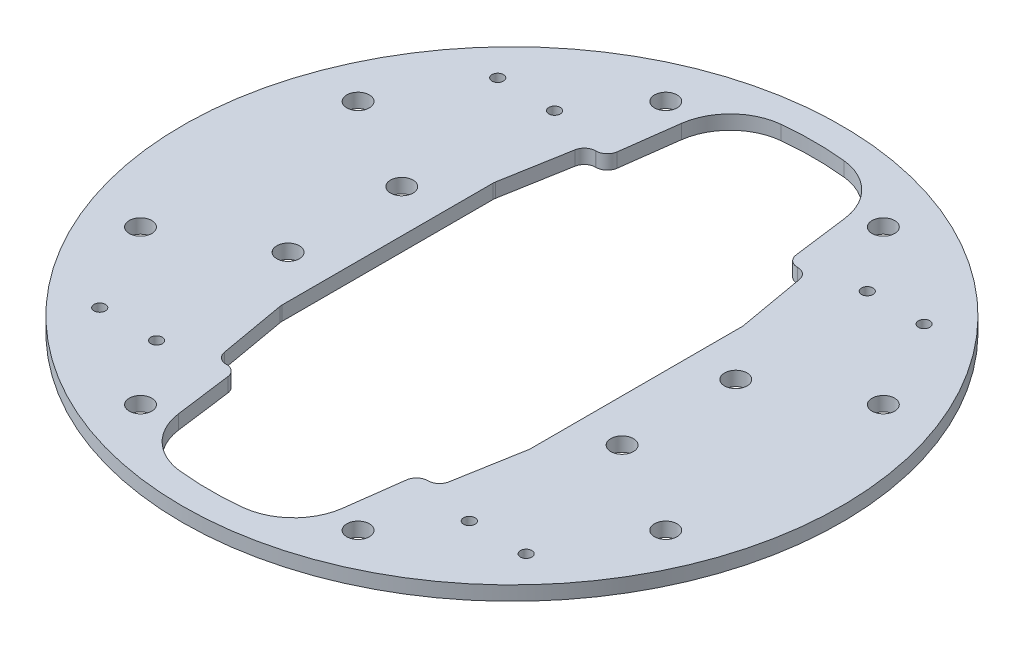
from build123d import *

# Parameters (mm, degrees)
SKETCH1_R                      = 147.24126
BOSS_EXTRUDE1_DEPTH            = 6.35
F_3_8_CLEARANCE_HOLE1_D        = 10.0838
SKETCH6_R                      = 2.38125
F_3_8_CLEARANCE_HOLE2_D        = 10.0838
FILLET1_R                      = 5.08
F_7_0_201_DIAMETER_HOLE1_D     = 5.1054
F_7_0_201_DIAMETER_HOLE1_DEPTH = 6.35


with BuildPart() as part:
    # Sketch1 → Boss-Extrude1 (new body)
    with BuildSketch(Plane(origin=(0, 0, 0), x_dir=(1, 0, 0), z_dir=(0, 1, 0))):
        with Locations(Location((0, 0, 0), (0, 0, 270))):
            Circle(SKETCH1_R)
        with BuildLine():
            Line((-36.612699479, 112.267654933), (-40.525102973, 82.55))
            Line((-40.525102973, 82.55), (-49.404280199, 82.55))
            Line((-49.404280199, 82.55), (-55.5625, 47.625))
            Line((-55.5625, 47.625), (-55.5625, -47.625))
            Line((-55.5625, -47.625), (-49.404280199, -82.55))
            Line((-49.404280199, -82.55), (-40.525102973, -82.55))
            Line((-40.525102973, -82.55), (-36.612699479, -112.267654933))
            ThreePointArc((-36.612699479, -112.267654933), (-29.152114648, -127.148076316), (-14.080127521, -134.213659845))
            ThreePointArc((-14.080127521, -134.213659845), (0, -134.9502), (14.080127521, -134.213659845))
            ThreePointArc((14.080127521, -134.213659845), (29.152114648, -127.148076316), (36.612699479, -112.267654933))
            Line((36.612699479, -112.267654933), (40.525102973, -82.55))
            Line((40.525102973, -82.55), (49.404280199, -82.55))
            Line((49.404280199, -82.55), (55.5625, -47.625))
            Line((55.5625, -47.625), (55.5625, 47.625))
            Line((55.5625, 47.625), (49.404280199, 82.55))
            Line((49.404280199, 82.55), (40.525102973, 82.55))
            Line((40.525102973, 82.55), (36.612699479, 112.267654933))
            ThreePointArc((36.612699479, 112.267654933), (29.152114648, 127.148076316), (14.080127521, 134.213659845))
            ThreePointArc((14.080127521, 134.213659845), (0, 134.9502), (-14.080127521, 134.213659845))
            ThreePointArc((-14.080127521, 134.213659845), (-29.152114648, 127.148076316), (-36.612699479, 112.267654933))
        make_face(mode=Mode.SUBTRACT)
    extrude(amount=BOSS_EXTRUDE1_DEPTH)

    # 3/8 Clearance Hole1 (through all)
    with Locations(Plane(origin=(0, 6.35, 0), x_dir=(1, 0, 0), z_dir=(0, 1, 0))):
        with Locations((-117.332700629, 48.60079591), (-48.60079591, 117.332700629), (48.60079591, 117.332700629), (117.332700629, 48.60079591), (117.332700629, -48.60079591), (48.60079591, -117.332700629), (-48.60079591, -117.332700629), (-117.332700629, -48.60079591)):
            Hole(F_3_8_CLEARANCE_HOLE1_D / 2)

    # Sketch6 → Cut-Revolve1 (revolve, cut)
    with BuildSketch(Plane(origin=(0, 0, 0), x_dir=(0, 0, -1), z_dir=(1, 0, 0)), mode=Mode.PRIVATE) as cut_revolve1_sk:
        with Locations((141.2875, -0.79375)):
            Circle(SKETCH6_R)
    revolve(cut_revolve1_sk.sketch.rotate(Axis((0, 0, 0), (0, -1, 0)), 180), axis=Axis((0, 0, 0), (0, -1, 0)), mode=Mode.SUBTRACT)

    # 3/8 Clearance Hole2 (through all)
    with Locations(Plane(origin=(0, 0, 0), x_dir=(-1, 0, 0), z_dir=(0, -1, 0))):
        with Locations((74.6125, -25.4), (74.6125, 25.4), (-74.6125, 25.4), (-74.6125, -25.4)):
            Hole(F_3_8_CLEARANCE_HOLE2_D / 2)

    # Fillet1
    fillet1_edges = [part.edges().sort_by_distance(p)[0] for p in [
        (-40.525102973, 3.175, -82.55),
        (-49.404280199, 3.175, -82.55),
        (-55.5625, 3.175, -47.625),
        (-55.5625, 3.175, 47.625),
        (-49.404280199, 3.175, 82.55),
        (-40.525102973, 3.175, 82.55),
        (40.525102973, 3.175, 82.55),
        (49.404280199, 3.175, 82.55),
        (55.5625, 3.175, 47.625),
        (55.5625, 3.175, -47.625),
        (49.404280199, 3.175, -82.55),
        (40.525102973, 3.175, -82.55),
    ]]
    fillet(fillet1_edges, radius=FILLET1_R)

    # #7 (0.201) Diameter Hole1
    with Locations(Plane(origin=(0, 6.35, 0), x_dir=(1, 0, 0), z_dir=(0, 1, 0))):
        with Locations((-69.85, -88.9), (-95.25, -88.9), (-95.25, 88.9), (-69.85, 88.9), (0, 0), (69.85, 88.9), (95.25, 88.9), (95.25, -88.9), (69.85, -88.9)):
            Hole(F_7_0_201_DIAMETER_HOLE1_D / 2, depth=F_7_0_201_DIAMETER_HOLE1_DEPTH)


solid = part.part
